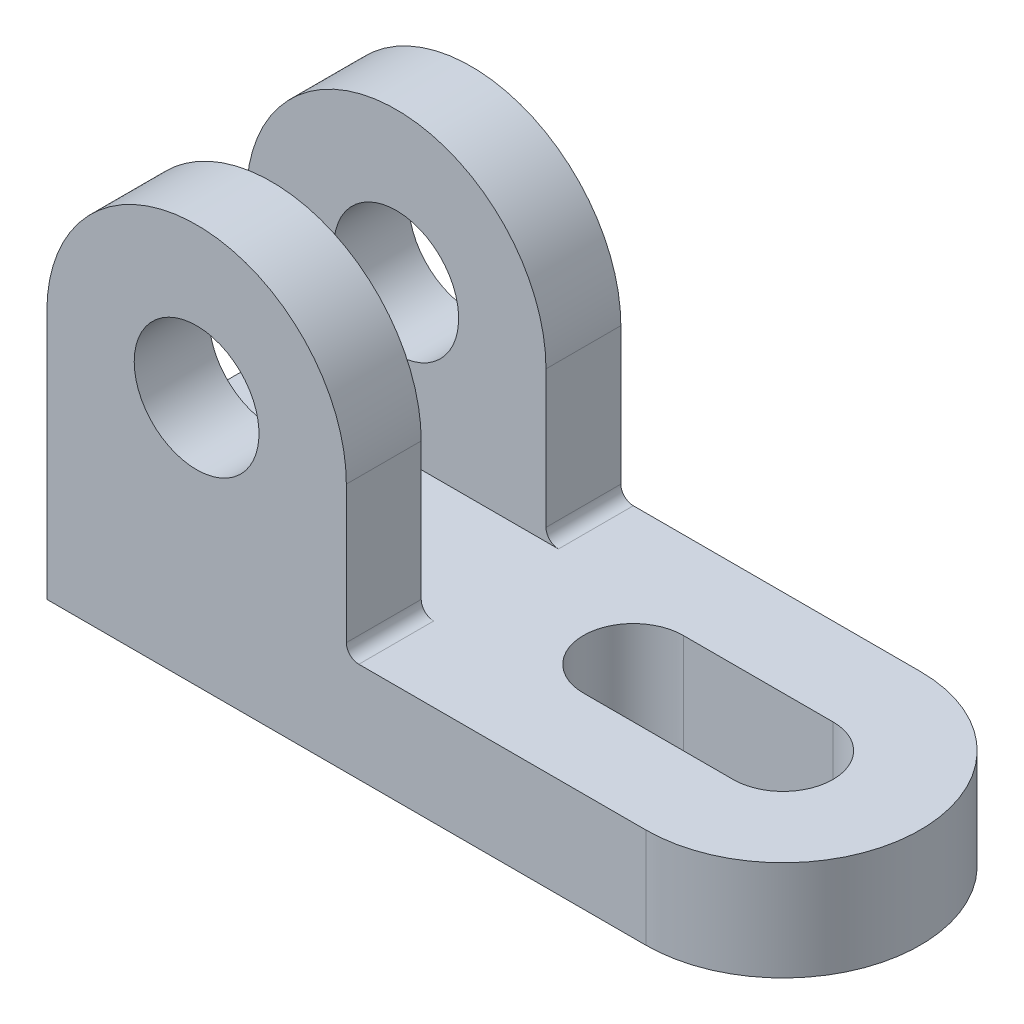
from build123d import *

# Parameters (mm, degrees)
BOSS_EXTRUDE1_DEPTH = 16
BOSS_EXTRUDE2_DEPTH = 12
BOSS_EXTRUDE4_START = -12
BOSS_EXTRUDE4_DEPTH = 12
SKETCH9_R           = 10
CUT_EXTRUDE1_DEPTH  = 105.556204981


with BuildPart() as part:
    # Sketch1 → Boss-Extrude1 (new body)
    with BuildSketch(Plane(origin=(0, 0, 0), x_dir=(1, 0, 0), z_dir=(0, 1, 0))):
        with BuildLine():
            Line((-48, 22), (48, 22))
            ThreePointArc((48, 22), (70, 0), (48, -22))
            Line((48, -22), (-48, -22))
            Line((-48, -22), (-48, 22))
        make_face()
        with BuildLine():
            Line((48, -8), (24, -8))
            ThreePointArc((24, -8), (16, 0), (24, 8))
            Line((24, 8), (48, 8))
            ThreePointArc((48, 8), (56, 0), (48, -8))
        make_face(mode=Mode.SUBTRACT)
    extrude(amount=BOSS_EXTRUDE1_DEPTH)

    # Sketch3 → Boss-Extrude2 (add)
    with BuildSketch(Plane.XY.offset(22)):
        with BuildLine():
            Line((2, 16), (0, 16))
            Line((0, 16), (-48, 16))
            Line((-48, 16), (-48, 40))
            ThreePointArc((-48, 40), (-24, 64), (0, 40))
            Line((0, 40), (0, 18))
            ThreePointArc((0, 18), (0.585786438, 16.585786438), (2, 16))
        make_face()
    extrude(amount=-BOSS_EXTRUDE2_DEPTH)

    # Sketch7 → Boss-Extrude4 (add)
    with BuildSketch(Plane(origin=(0, 0, -22), x_dir=(-1, 0, 0), z_dir=(0, 0, -1)).offset(BOSS_EXTRUDE4_START)):
        with BuildLine():
            Line((0, 16), (-2, 16))
            ThreePointArc((-2, 16), (-0.585786438, 16.585786438), (0, 18))
            Line((0, 18), (0, 40))
            ThreePointArc((0, 40), (24, 64), (48, 40))
            Line((48, 40), (48, 16))
            Line((48, 16), (0, 16))
        make_face()
    extrude(amount=BOSS_EXTRUDE4_DEPTH)

    # Sketch9 → Cut-Extrude1 (cut, through all)
    with BuildSketch(Plane(origin=(0, 0, -22), x_dir=(-1, 0, 0), z_dir=(0, 0, -1))):
        with Locations((24, 40)):
            Circle(SKETCH9_R)
    extrude(amount=-CUT_EXTRUDE1_DEPTH, mode=Mode.SUBTRACT)


solid = part.part
